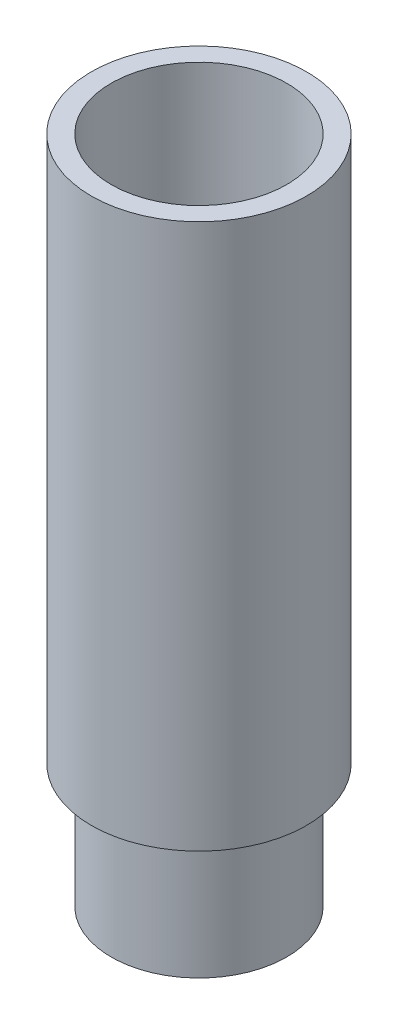
from build123d import *

# Parameters (mm, degrees)
SKETCH1_R                            = 9.0043
SKETCH1_R_2                          = 6.9723
BOSS_EXTRUDE1_DEPTH                  = 19.05
BOSS_EXTRUDE2_DEPTH                  = 49.53
BOSS_EXTRUDE2_DEPTH_BACK             = 6.35
SKETCH2_R                            = 11.0363
SKETCH2_R_2                          = 9.0043
BOSS_EXTRUDE3_REACH                  = 72.334
BOSS_EXTRUDE3_END_RADIUS             = 6.9723
SKETCH3_W                            = 2.54
SKETCH3_H                            = 2.54
BOSS_EXTRUDE3_DIRECTION_2_REACH      = 72.334
BOSS_EXTRUDE3_DIRECTION_2_END_RADIUS = 6.9723


with BuildPart() as part:
    # Sketch1 → Boss-Extrude1 (new body)
    with BuildSketch(Plane(origin=(0, 0, 0), x_dir=(1, 0, 0), z_dir=(0, 1, 0))):
        with Locations(Location((0, 0, 0), (0, 0, 90))):
            Circle(SKETCH1_R)
        with Locations(Location((0, 0, 0), (0, 0, 90))):
            Circle(SKETCH1_R_2, mode=Mode.SUBTRACT)
    extrude(amount=BOSS_EXTRUDE1_DEPTH)

    # Sketch2 → Boss-Extrude2 (add, two sides: drawn at the far end of the back side and taken through both)
    with BuildSketch(Plane(origin=(0, 19.05, 0), x_dir=(1, 0, 0), z_dir=(0, 1, 0)).offset(-BOSS_EXTRUDE2_DEPTH_BACK)):
        with Locations(Location((0, 0, 0), (0, 0, 270))):
            Circle(SKETCH2_R)
        with Locations(Location((0, 0, 0), (0, 0, 90))):
            Circle(SKETCH2_R_2, mode=Mode.SUBTRACT)
    extrude(amount=BOSS_EXTRUDE2_DEPTH + BOSS_EXTRUDE2_DEPTH_BACK)

    # Boss-Extrude3: up to this cylinder (the profile starts inside it)
    boss_extrude3_end = Plane(origin=(0, 1.27, 0), z_dir=(0, -1, 0)) * Cylinder(BOSS_EXTRUDE3_END_RADIUS, 159.6126, mode=Mode.PRIVATE)
    # Sketch3 → Boss-Extrude3 (add, up to the surface)
    with BuildSketch(Plane.XY, mode=Mode.PRIVATE) as boss_extrude3_sk1:
        with Locations((1.27, 1.27)):
            Rectangle(SKETCH3_W, SKETCH3_H)
    boss_extrude3_tool1 = extrude(boss_extrude3_sk1.sketch, amount=BOSS_EXTRUDE3_REACH, mode=Mode.PRIVATE) & boss_extrude3_end
    add(boss_extrude3_tool1.solids().sort_by_distance((1.27, 1.27, 0))[0])

    # Boss-Extrude3 direction 2: up to this cylinder (the profile starts inside it)
    boss_extrude3_direction_2_end = Plane(origin=(0, 1.27, 0), z_dir=(0, -1, 0)) * Cylinder(BOSS_EXTRUDE3_DIRECTION_2_END_RADIUS, 159.6126, mode=Mode.PRIVATE)
    # Sketch3 → Boss-Extrude3 direction 2 (add, up to the surface)
    with BuildSketch(Plane.XY, mode=Mode.PRIVATE) as boss_extrude3_direction_2_sk1:
        with Locations((1.27, 1.27)):
            Rectangle(SKETCH3_W, SKETCH3_H)
    boss_extrude3_direction_2_tool1 = extrude(boss_extrude3_direction_2_sk1.sketch, amount=-BOSS_EXTRUDE3_DIRECTION_2_REACH, mode=Mode.PRIVATE) & boss_extrude3_direction_2_end
    add(boss_extrude3_direction_2_tool1.solids().sort_by_distance((1.27, 1.27, 0))[0])


solid = part.part
